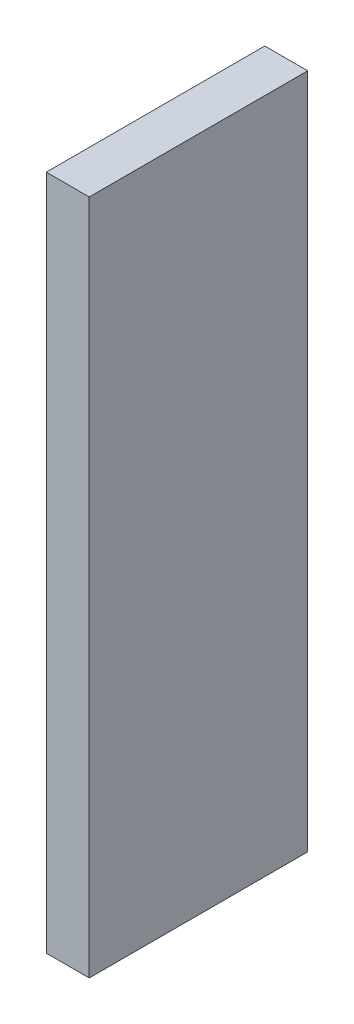
from build123d import *

# Parameters (mm, degrees)
SKETCH1_W           = 32.3
SKETCH1_H           = 100
BOSS_EXTRUDE1_DEPTH = 6.35


with BuildPart() as part:
    # Sketch1 → Boss-Extrude1 (new body)
    with BuildSketch(Plane(origin=(0, 0, 0), x_dir=(0, 0, -1), z_dir=(1, 0, 0))):
        Rectangle(SKETCH1_W, SKETCH1_H)
    extrude(amount=BOSS_EXTRUDE1_DEPTH)


solid = part.part
